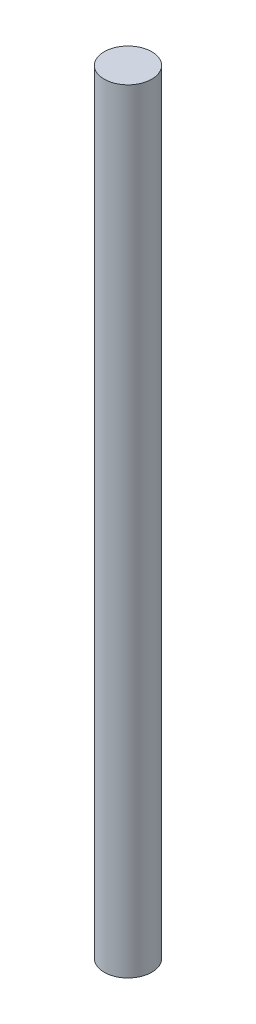
from build123d import *

# Parameters (mm, degrees)
CROQUIS1_R              = 4
SALIENTE_EXTRUIR1_DEPTH = 130


with BuildPart() as part:
    # Croquis1 → Saliente-Extruir1 (new body)
    with BuildSketch(Plane(origin=(0, 0, 0), x_dir=(1, 0, 0), z_dir=(0, 1, 0))):
        with Locations(Location((0, 0, 0), (0, 0, 270))):
            Circle(CROQUIS1_R)
    extrude(amount=SALIENTE_EXTRUIR1_DEPTH)


solid = part.part
